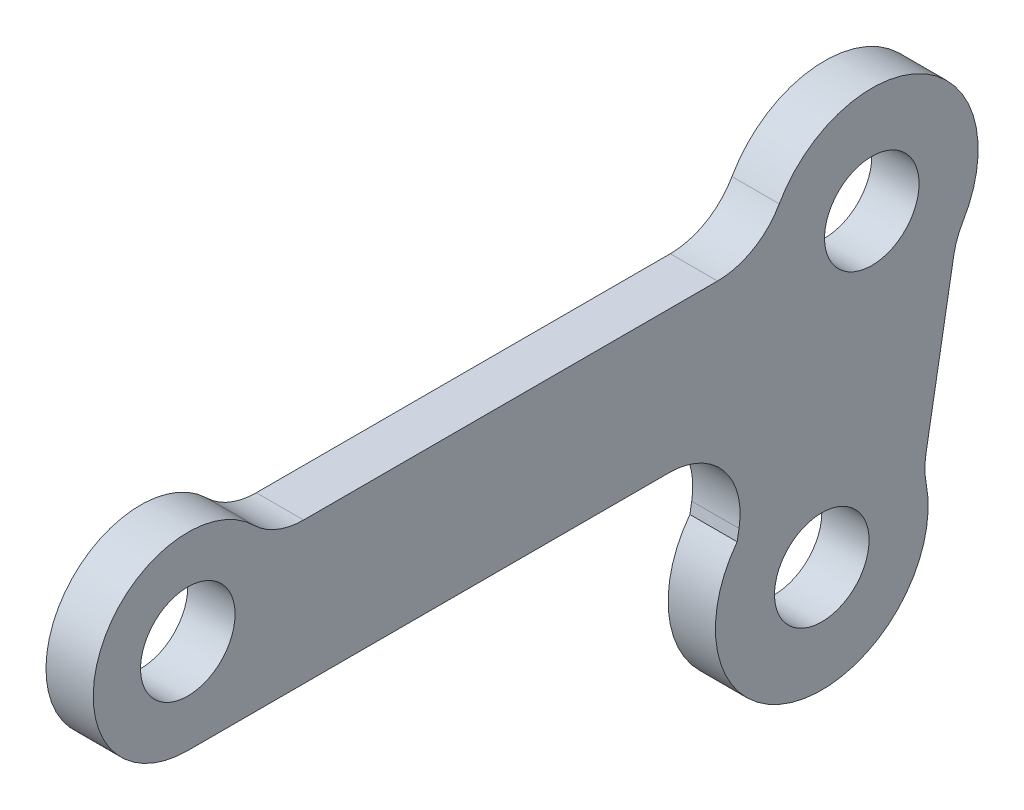
from build123d import *

# Parameters (mm, degrees)
EXTRUDE_1_DEPTH     = 2
SKETCH_1_3_R        = 2
CUT_EXTRUDE_1_DEPTH = 34.773569821
FILLET_1_R          = 3


with BuildPart() as part:
    # 草图1 → 凸台-拉伸1 (new body)
    with BuildSketch(Plane(origin=(0, 0, 0), x_dir=(0, 0, -1), z_dir=(1, 0, 0))):
        with BuildLine():
            Line((-25, -6), (-25, 0))
            Line((-25, 0), (-21.535898385, 0))
            ThreePointArc((-21.535898385, 0), (-28.464101615, 0), (-25, -6))
        make_face()
        with BuildLine():
            Line((-21.535898385, 0), (-25, 0))
            Line((-25, 0), (-25, -6))
            ThreePointArc((-25, -6), (-22.171572875, -4.828427125), (-21, -2))
            ThreePointArc((-21, -2), (-21.136296695, -0.96472382), (-21.535898385, 0))
        make_face()
        with BuildLine():
            Line((-0.506839272, 0), (-21.535898385, 0))
            ThreePointArc((-21.535898385, 0), (-21.136296695, -0.96472382), (-21, -2))
            ThreePointArc((-21, -2), (-22.171572875, -4.828427125), (-25, -6))
            Line((-25, -6), (-1.057961884, -6))
            Line((-1.057961884, -6), (-0.357984889, -2.030233193))
            ThreePointArc((-0.357984889, -2.030233193), (-0.548722311, -1.02364433), (-0.506839272, 0))
        make_face()
        with BuildLine():
            ThreePointArc((8.439231012, -0.694592711), (4.2875726, 3.791904602), (-0.506839272, 0))
            Line((-0.506839272, 0), (0, 0))
            Line((0, 0), (7.878462024, -1.389185421))
            Line((7.878462024, -1.389185421), (7.520477135, -3.419418615))
            ThreePointArc((7.520477135, -3.419418615), (8.203360909, -2.132367458), (8.439231012, -0.694592711))
        make_face()
        with BuildLine():
            Line((0, 0), (-0.506839272, 0))
            ThreePointArc((-0.506839272, 0), (-0.548722311, -1.02364433), (-0.357984889, -2.030233193))
            Line((-0.357984889, -2.030233193), (0, 0))
        make_face()
        with BuildLine():
            Line((-0.357984889, -2.030233193), (-1.057961884, -6))
            Line((-1.057961884, -6), (0, -6))
            Line((0, -6), (0, -2.870014287))
            ThreePointArc((0, -2.870014287), (-0.200342941, -2.459225106), (-0.357984889, -2.030233193))
        make_face()
        with BuildLine():
            Line((0, -6), (-1.057961884, -6))
            Line((-1.057961884, -6), (-1.757938879, -9.969766807))
            ThreePointArc((-1.757938879, -9.969766807), (2.604724043, -8.262957822), (6.120523145, -11.358952228))
            Line((6.120523145, -11.358952228), (7.520477135, -3.419418615))
            ThreePointArc((7.520477135, -3.419418615), (3.611359735, -5.182632419), (0, -2.870014287))
            Line((0, -2.870014287), (0, -6))
        make_face()
        with BuildLine():
            Line((7.878462024, -1.389185421), (0, 0))
            Line((0, 0), (0, -2.870014287))
            ThreePointArc((0, -2.870014287), (3.611359735, -5.182632419), (7.520477135, -3.419418615))
            Line((7.520477135, -3.419418615), (7.878462024, -1.389185421))
        make_face()
        with BuildLine():
            Line((0, -2.870014287), (0, 0))
            Line((0, 0), (-0.357984889, -2.030233193))
            ThreePointArc((-0.357984889, -2.030233193), (-0.200342941, -2.459225106), (0, -2.870014287))
        make_face()
        with BuildLine():
            ThreePointArc((6.120523145, -11.358952228), (2.604724043, -8.262957822), (-1.757938879, -9.969766807))
            Line((-1.757938879, -9.969766807), (-2.115923769, -12))
            Line((-2.115923769, -12), (5.762538256, -13.389185421))
            Line((5.762538256, -13.389185421), (6.120523145, -11.358952228))
        make_face()
        with BuildLine():
            Line((-2.115923769, -12), (-1.757938879, -9.969766807))
            ThreePointArc((-1.757938879, -9.969766807), (0.385532496, -16.958722607), (6.323307244, -12.694592711))
            ThreePointArc((6.323307244, -12.694592711), (6.27232239, -12.019119379), (6.120523145, -11.358952228))
            Line((6.120523145, -11.358952228), (5.762538256, -13.389185421))
            Line((5.762538256, -13.389185421), (-2.115923769, -12))
        make_face()
    extrude(amount=EXTRUDE_1_DEPTH)

    # 草图1<3> → 切除-拉伸1 (cut, through all)
    with BuildSketch(Plane(origin=(0, 0, 0), x_dir=(0, 0, -1), z_dir=(1, 0, 0))):
        with Locations((-25, -2)):
            Circle(SKETCH_1_3_R)
        with Locations((3.939231012, -0.694592711)):
            Circle(SKETCH_1_3_R)
        with Locations((1.823307244, -12.694592711)):
            Circle(SKETCH_1_3_R)
    extrude(amount=CUT_EXTRUDE_1_DEPTH, mode=Mode.SUBTRACT)

    # 圆角1
    fillet_1_edges = [part.edges().sort_by_distance(p)[0] for p in [
        (1, -11.358952228, -6.120523145),
        (1, -3.419418615, -7.520477135),
        (1, 0, 0.506839272),
        (1, 0, 21.535898385),
        (1, -6, 1.057961884),
    ]]
    fillet(fillet_1_edges, radius=FILLET_1_R)


solid = part.part
